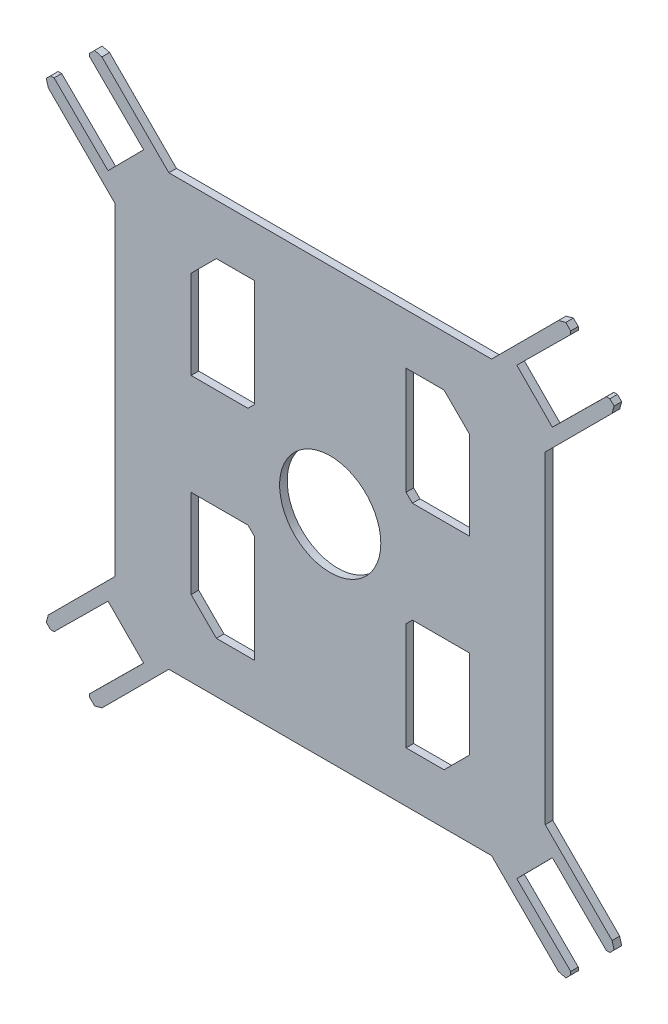
from build123d import *

# Parameters (mm, degrees)
BOSS_EXTRUDE1_DEPTH = 3
SKETCH2_R           = 20
CUT_EXTRUDE1_DEPTH  = 10


with BuildPart() as part:
    # Sketch1 → Boss-Extrude1 (new body)
    with BuildSketch(Plane.XY):
        Polygon((158.754970941, -72.897106565), (180.070576123, -94.00741153), (180.070576123, -95.284756679), (178.131724855, -97.223607947), (175.233947376, -96.447150811), (148.786793436, -69.999996871), (21.213203436, -69.999996871), (-5.233950505, -96.447150811), (-8.131727984, -97.223607947), (-10.070579252, -95.284756679), (-10.070579252, -94.00741153), (11.24502593, -72.897106565), (-2.828675487, -58.686536734), (-24.144280669, -79.796841699), (-25.558494231, -79.796841699), (-27.223611076, -78.131724855), (-26.44715394, -75.233947376), (0, -48.786793435), (0, 78.786796565), (-26.44715394, 105.233950505), (-27.223611076, 108.131727984), (-25.558494231, 109.796844828), (-24.144280669, 109.796844828), (-2.828675487, 88.686539863), (11.24502593, 102.897109694), (-10.070579252, 124.007414659), (-10.070579252, 125.284759808), (-8.131727984, 127.223611076), (-5.233950505, 126.447153941), (21.213203436, 100), (148.786793436, 100), (175.233947376, 126.447153941), (178.131724855, 127.223611076), (180.070576123, 125.284759808), (180.070576123, 124.007414659), (158.754970941, 102.897109694), (172.828672358, 88.686539863), (194.14427754, 109.796844828), (195.558491102, 109.796844828), (197.223607947, 108.131727984), (196.447150812, 105.233950505), (169.999996871, 78.786796565), (169.999996871, -48.786793435), (196.447150812, -75.233947376), (197.223607947, -78.131724855), (195.558491102, -79.796841699), (194.14427754, -79.796841699), (172.828672358, -58.686536734), align=None)
    extrude(amount=BOSS_EXTRUDE1_DEPTH)

    # Sketch2 → Cut-Extrude1 (cut)
    with BuildSketch(Plane.XY.offset(3)):
        with Locations((84.999998436, 15.000001565)):
            Circle(SKETCH2_R)
        Polygon((30, 70), (40, 80), (54.999998436, 80), (54.999998436, 37.500001565), (52.499998436, 35.000001565), (30, 35.000001565), align=None)
        Polygon((30, -4.999998435), (52.499998436, -4.999998435), (54.999998436, -7.499998435), (54.999998436, -49.999996871), (40, -49.999996871), (30, -39.999996871), align=None)
        Polygon((139.999996871, -39.999996871), (139.999996871, -4.999998435), (117.499998436, -4.999998435), (114.999998436, -7.499998435), (114.999998436, -49.999996871), (129.999996871, -49.999996871), align=None)
        Polygon((139.999996871, 35.000001565), (117.499998436, 35.000001565), (114.999998436, 37.500001565), (114.999998436, 80), (129.999996871, 80), (139.999996871, 70), align=None)
    extrude(amount=-CUT_EXTRUDE1_DEPTH, mode=Mode.SUBTRACT)


solid = part.part
